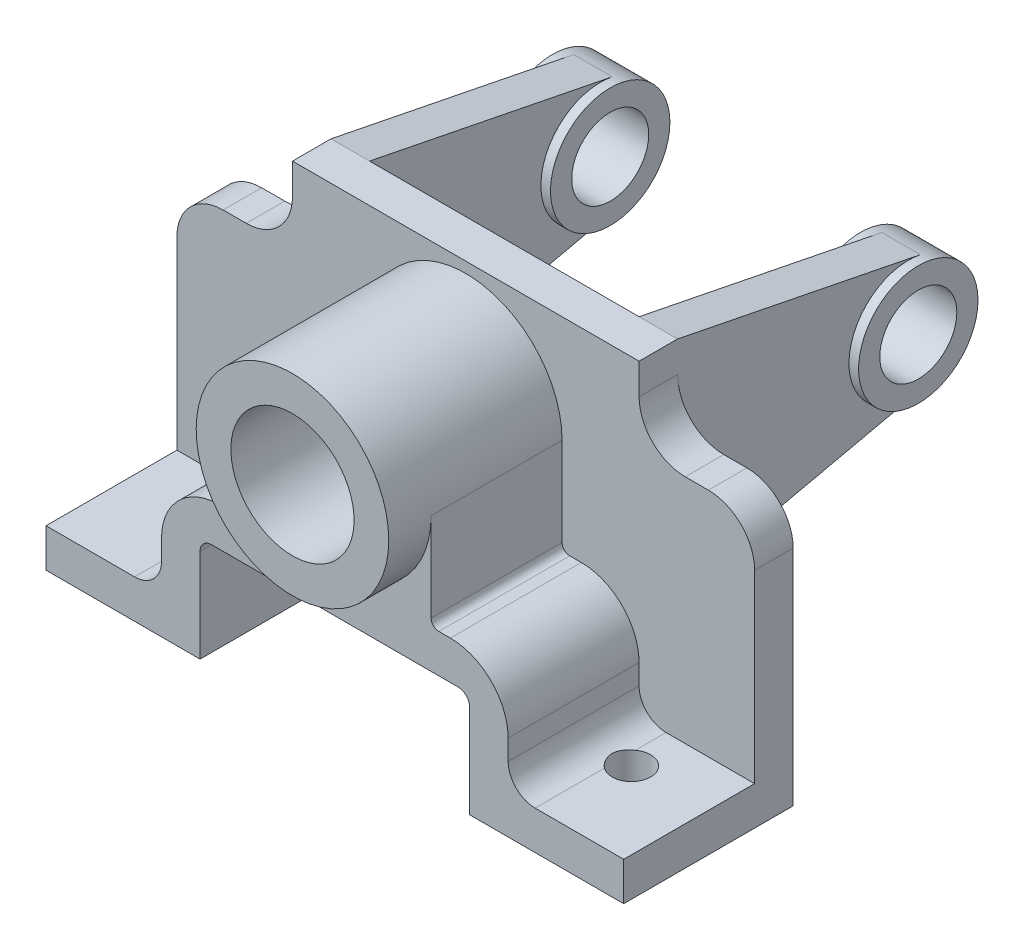
from build123d import *

# Parameters (mm, degrees)
BOSS_EXTRUDE2_DEPTH  = 10
SKETCH2_R            = 25
SKETCH2_R_2          = 16
BOSS_EXTRUDE4_DEPTH  = 45
BOSS_EXTRUDE5_START  = 34
BOSS_EXTRUDE5_DEPTH  = 34
SKETCH4_R            = 5
CUT_EXTRUDE1_DEPTH   = 34
SKETCH6_R            = 15.5
SKETCH6_R_2          = 10
BOSS_EXTRUDE6_DEPTH  = 7.5
BOSS_EXTRUDE8_DEPTH  = 5
SKETCH8_R            = 15.5
SKETCH8_R_2          = 10
BOSS_EXTRUDE9_DEPTH  = 7.5
BOSS_EXTRUDE10_DEPTH = 5


with BuildPart() as part:
    # Sketch1 → Boss-Extrude2 (new body)
    with BuildSketch(Plane.XY):
        with BuildLine():
            Line((-32, 0), (32, 0))
            ThreePointArc((32, 0), (34.121320344, -0.878679656), (35, -3))
            Line((35, -3), (35, -27.235915493))
            Line((35, -27.235915493), (75, -27.235915493))
            Line((75, -27.235915493), (75, 30.764084507))
            ThreePointArc((75, 30.764084507), (71.485281374, 39.249365881), (63, 42.764084507))
            Line((63, 42.764084507), (57, 42.764084507))
            ThreePointArc((57, 42.764084507), (48.514718626, 46.278803133), (45, 54.764084507))
            Line((45, 54.764084507), (45, 62.764084507))
            Line((45, 62.764084507), (-45, 62.764084507))
            Line((-45, 62.764084507), (-45, 54.764084507))
            ThreePointArc((-45, 54.764084507), (-48.514718626, 46.278803133), (-57, 42.764084507))
            Line((-57, 42.764084507), (-63, 42.764084507))
            ThreePointArc((-63, 42.764084507), (-71.485281374, 39.249365881), (-75, 30.764084507))
            Line((-75, 30.764084507), (-75, -27.235915493))
            Line((-75, -27.235915493), (-35, -27.235915493))
            Line((-35, -27.235915493), (-35, -3))
            ThreePointArc((-35, -3), (-34.121320344, -0.878679656), (-32, 0))
        make_face()
    extrude(amount=-BOSS_EXTRUDE2_DEPTH)

    # Sketch2 → Boss-Extrude4 (add)
    with BuildSketch(Plane.XY):
        with Locations(Location((0, 35, 0), (0, 0, 180))):
            Circle(SKETCH2_R)
        with Locations(Location((0, 35, 0), (0, 0, 180))):
            Circle(SKETCH2_R_2, mode=Mode.SUBTRACT)
    extrude(amount=BOSS_EXTRUDE4_DEPTH)

    # Sketch3 → Boss-Extrude5 (add)
    with BuildSketch(Plane.XY.offset(BOSS_EXTRUDE5_START)):
        with BuildLine():
            Line((-75, -17.235915493), (-52, -17.235915493))
            ThreePointArc((-52, -17.235915493), (-47.050252532, -15.185662961), (-45, -10.235915493))
            Line((-45, -10.235915493), (-45, -5))
            ThreePointArc((-45, -5), (-40.606601718, 5.606601718), (-30, 10))
            Line((-30, 10), (-27, 10))
            ThreePointArc((-27, 10), (-25.585786438, 10.585786438), (-25, 12))
            Line((-25, 12), (-25, 35))
            ThreePointArc((-25, 35), (0, 10), (25, 35))
            Line((25, 35), (25, 12))
            ThreePointArc((25, 12), (25.585786438, 10.585786438), (27, 10))
            Line((27, 10), (30, 10))
            ThreePointArc((30, 10), (40.606601718, 5.606601718), (45, -5))
            Line((45, -5), (45, -10.235915493))
            ThreePointArc((45, -10.235915493), (47.050252532, -15.185662961), (52, -17.235915493))
            Line((52, -17.235915493), (75, -17.235915493))
            Line((75, -17.235915493), (75, -27.235915493))
            Line((75, -27.235915493), (35, -27.235915493))
            Line((35, -27.235915493), (35, -3))
            ThreePointArc((35, -3), (34.121320344, -0.878679656), (32, 0))
            Line((32, 0), (-32, 0))
            ThreePointArc((-32, 0), (-34.121320344, -0.878679656), (-35, -3))
            Line((-35, -3), (-35, -27.235915493))
            Line((-35, -27.235915493), (-75, -27.235915493))
            Line((-75, -27.235915493), (-75, -17.235915493))
        make_face()
    extrude(amount=-BOSS_EXTRUDE5_DEPTH)

    # Sketch4 → Cut-Extrude1 (cut)
    with BuildSketch(Plane.XZ.offset(27.235915493)):
        with Locations(Location((-55, 12, 0), (0, 0, 270))):
            Circle(SKETCH4_R)
        with Locations(Location((55, 12, 0), (0, 0, 270))):
            Circle(SKETCH4_R)
    extrude(amount=-CUT_EXTRUDE1_DEPTH, mode=Mode.SUBTRACT)



with BuildPart() as body_2:
    # Sketch6 → Boss-Extrude6 (new, symmetric)
    with BuildSketch(Plane(origin=(40, 0, 0), x_dir=(0, 0, -1), z_dir=(1, 0, 0))):
        with Locations((70, 35)):
            Circle(SKETCH6_R)
        with Locations((70, 35)):
            Circle(SKETCH6_R_2, mode=Mode.SUBTRACT)
    extrude(amount=BOSS_EXTRUDE6_DEPTH, both=True)


with BuildPart() as part_1:
    add(part.part)

    add(body_2.part)  # Boss-Extrude8 merges body 2
    # Sketch7 → Boss-Extrude8 (add, symmetric)
    with BuildSketch(Plane(origin=(40, 0, 0), x_dir=(0, 0, -1), z_dir=(1, 0, 0))):
        with BuildLine():
            Line((10, 62.764084507), (73.029857486, 50.200985613))
            ThreePointArc((73.029857486, 50.200985613), (54.50102976, 34.821334149), (73.379467389, 19.872898488))
            Line((73.379467389, 19.872898488), (10, 5.71361999))
            Line((10, 5.71361999), (10, 62.764084507))
        make_face()
    extrude(amount=BOSS_EXTRUDE8_DEPTH, both=True)



with BuildPart() as body_2_2:
    # Sketch8 → Boss-Extrude9 (new, symmetric)
    with BuildSketch(Plane(origin=(-40, 0, 0), x_dir=(0, 0, -1), z_dir=(1, 0, 0))):
        with Locations((70, 35)):
            Circle(SKETCH8_R)
        with Locations((70, 35)):
            Circle(SKETCH8_R_2, mode=Mode.SUBTRACT)
    extrude(amount=BOSS_EXTRUDE9_DEPTH, both=True)


with BuildPart() as part_2:
    add(part_1.part)

    add(body_2_2.part)  # Boss-Extrude10 merges body 2 2
    # Sketch9 → Boss-Extrude10 (add, symmetric)
    with BuildSketch(Plane(origin=(-40, 0, 0), x_dir=(0, 0, -1), z_dir=(1, 0, 0))):
        with BuildLine():
            Line((73.029857486, 50.200985613), (10, 62.764084507))
            Line((10, 62.764084507), (10, 5.71361999))
            Line((10, 5.71361999), (73.379467389, 19.872898488))
            ThreePointArc((73.379467389, 19.872898488), (54.50102976, 34.821334149), (73.029857486, 50.200985613))
        make_face()
    extrude(amount=BOSS_EXTRUDE10_DEPTH, both=True)


solid = part_2.part
